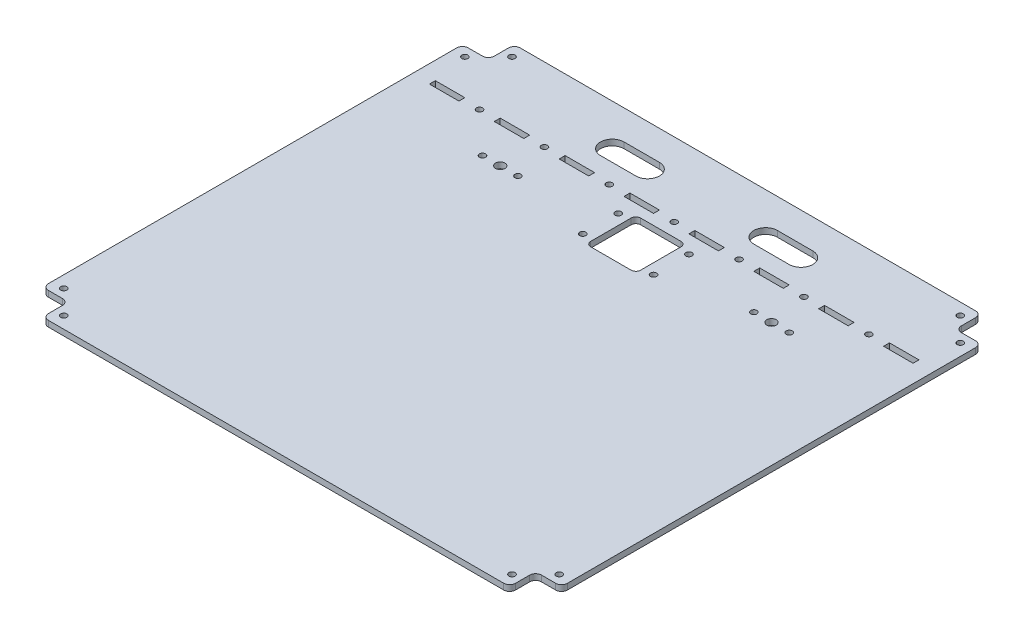
from build123d import *

# Parameters (mm, degrees)
SKETCH1_W               = 440
SKETCH1_H               = 400
BOSS_EXTRUDE1_DEPTH     = 2.5
SKETCH2_W               = 22
SKETCH2_H               = 22
CUT_EXTRUDE1_DEPTH      = 5
SKETCH3_R               = 2.6
CUT_EXTRUDE2_DEPTH      = 5
MIRROR2_COPY_1_SKETCH_W = 22
MIRROR2_COPY_1_SKETCH_H = 22
MIRROR2_COPY_1_DEPTH    = 5
MIRROR2_COPY_2_SKETCH_R = 2.6
MIRROR2_COPY_2_DEPTH    = 5
FILLET1_R               = 5
SKETCH4_W               = 25
SKETCH4_H               = 5
CUT_EXTRUDE3_DEPTH      = 5
LPATTERN1_COUNT         = 8
LPATTERN1_PITCH         = 55
SKETCH5_R               = 2.6
CUT_EXTRUDE4_DEPTH      = 5
LPATTERN2_COUNT         = 7
LPATTERN2_PITCH         = 55
SKETCH6_W               = 42.3
SKETCH6_H               = 42.3
CUT_EXTRUDE5_DEPTH      = 5
FILLET2_R               = 4
SKETCH7_R               = 2.6
CUT_EXTRUDE7_DEPTH      = 5
LPATTERN3_COUNT         = 2
LPATTERN3_PITCH         = 60
LPATTERN3_COUNT_DIR2    = 2
LPATTERN3_PITCH_DIR2    = 30
SKETCH8_R               = 4
SKETCH8_R_2             = 2.6
CUT_EXTRUDE8_DEPTH      = 5
CUT_EXTRUDE9_DEPTH      = 5


with BuildPart() as part:
    # Sketch1 → Boss-Extrude1 (new, symmetric)
    with BuildSketch(Plane(origin=(0, 0, 0), x_dir=(1, 0, 0), z_dir=(0, 1, 0))):
        Rectangle(SKETCH1_W, SKETCH1_H)
    extrude(amount=BOSS_EXTRUDE1_DEPTH, both=True)

    # Sketch2 → Cut-Extrude1 (cut)
    with BuildSketch(Plane(origin=(0, 2.5, 0), x_dir=(1, 0, 0), z_dir=(0, 1, 0))):
        with Locations((209, 189)):
            Rectangle(SKETCH2_W, SKETCH2_H)
    cut_extrude1 = extrude(amount=-CUT_EXTRUDE1_DEPTH, mode=Mode.SUBTRACT)

    # Sketch3 → Cut-Extrude2 (cut)
    with BuildSketch(Plane(origin=(0, 2.5, 0), x_dir=(1, 0, 0), z_dir=(0, 1, 0))):
        with Locations(Location((190, 190, 0), (0, 0, 270))):
            Circle(SKETCH3_R)
        with Locations(Location((210, 170, 0), (0, 0, 270))):
            Circle(SKETCH3_R)
    cut_extrude2 = extrude(amount=-CUT_EXTRUDE2_DEPTH, mode=Mode.SUBTRACT)

    # Mirror1: Cut-Extrude1, Cut-Extrude2 across plane
    add(cut_extrude1.mirror(Plane(origin=(0, 0, 0), x_dir=(0, 0, 1), z_dir=(1, 0, 0))), mode=Mode.SUBTRACT)
    add(cut_extrude2.mirror(Plane(origin=(0, 0, 0), x_dir=(0, 0, 1), z_dir=(1, 0, 0))), mode=Mode.SUBTRACT)

    # Mirror2: Cut-Extrude1, Cut-Extrude2 across plane
    add(cut_extrude1.mirror(Plane.XY), mode=Mode.SUBTRACT)
    add(cut_extrude2.mirror(Plane.XY), mode=Mode.SUBTRACT)

    # Mirror2 copy 1 sketch → Mirror2 copy 1 (cut)
    with BuildSketch(Plane(origin=(0, 2.5, 0), x_dir=(-1, 0, 0), z_dir=(0, 1, 0))):
        with Locations((209, 189)):
            Rectangle(MIRROR2_COPY_1_SKETCH_W, MIRROR2_COPY_1_SKETCH_H)
    extrude(amount=-MIRROR2_COPY_1_DEPTH, mode=Mode.SUBTRACT)

    # Mirror2 copy 2 sketch → Mirror2 copy 2 (cut)
    with BuildSketch(Plane(origin=(0, 2.5, 0), x_dir=(-1, 0, 0), z_dir=(0, 1, 0))):
        with Locations(Location((190, 190, 0), (0, 0, 270))):
            Circle(MIRROR2_COPY_2_SKETCH_R)
        with Locations(Location((210, 170, 0), (0, 0, 270))):
            Circle(MIRROR2_COPY_2_SKETCH_R)
    extrude(amount=-MIRROR2_COPY_2_DEPTH, mode=Mode.SUBTRACT)

    # Fillet1
    fillet1_edges = [part.edges().sort_by_distance(p)[0] for p in [
        (220, 0, -178),
        (198, 0, -178),
        (198, 0, -200),
        (-198, 0, -178),
        (-198, 0, -200),
        (-220, 0, -178),
        (-220, 0, 178),
        (-198, 0, 178),
        (-198, 0, 200),
        (198, 0, 178),
        (198, 0, 200),
        (220, 0, 178),
    ]]
    fillet(fillet1_edges, radius=FILLET1_R)

    # Sketch4 → Cut-Extrude3 (cut)
    with BuildSketch(Plane(origin=(0, 2.5, 0), x_dir=(1, 0, 0), z_dir=(0, 1, 0))):
        with Locations((-192.5, 137.5)):
            Rectangle(SKETCH4_W, SKETCH4_H)
    cut_extrude3 = extrude(amount=-CUT_EXTRUDE3_DEPTH, mode=Mode.SUBTRACT)

    # LPattern1: Cut-Extrude3 ×8
    with Locations(*[(i * LPATTERN1_PITCH, 0, 0) for i in range(1, LPATTERN1_COUNT)]):
        add(cut_extrude3, mode=Mode.SUBTRACT)

    # Sketch5 → Cut-Extrude4 (cut)
    with BuildSketch(Plane(origin=(0, 2.5, 0), x_dir=(1, 0, 0), z_dir=(0, 1, 0))):
        with Locations(Location((-165, 137.5, 0), (0, 0, 270))):
            Circle(SKETCH5_R)
    cut_extrude4 = extrude(amount=-CUT_EXTRUDE4_DEPTH, mode=Mode.SUBTRACT)

    # LPattern2: Cut-Extrude4 ×7
    with Locations(*[(i * LPATTERN2_PITCH, 0, 0) for i in range(1, LPATTERN2_COUNT)]):
        add(cut_extrude4, mode=Mode.SUBTRACT)

    # Sketch6 → Cut-Extrude5 (cut)
    with BuildSketch(Plane(origin=(0, 2.5, 0), x_dir=(1, 0, 0), z_dir=(0, 1, 0))):
        with Locations((0, 105)):
            Rectangle(SKETCH6_W, SKETCH6_H)
    extrude(amount=-CUT_EXTRUDE5_DEPTH, mode=Mode.SUBTRACT)

    # Fillet2
    fillet2_edges = [part.edges().sort_by_distance(p)[0] for p in [
        (21.15, 0, -126.15),
        (21.15, 0, -83.85),
        (-21.15, 0, -83.85),
        (-21.15, 0, -126.15),
    ]]
    fillet(fillet2_edges, radius=FILLET2_R)

    # Sketch7 → Cut-Extrude7 (cut)
    with BuildSketch(Plane(origin=(0, 2.5, 0), x_dir=(1, 0, 0), z_dir=(0, 1, 0))):
        with Locations(Location((30, 120, 0), (0, 0, 270))):
            Circle(SKETCH7_R)
    cut_extrude7 = extrude(amount=-CUT_EXTRUDE7_DEPTH, mode=Mode.SUBTRACT)

    # LPattern3: Cut-Extrude7 2 × 2
    with Locations(*[(-i * LPATTERN3_PITCH, 0, j * LPATTERN3_PITCH_DIR2) for i in range(LPATTERN3_COUNT) for j in range(LPATTERN3_COUNT_DIR2) if (i, j) != (0, 0)]):
        add(cut_extrude7, mode=Mode.SUBTRACT)

    # Sketch8 → Cut-Extrude8 (cut)
    with BuildSketch(Plane(origin=(0, 2.5, 0), x_dir=(1, 0, 0), z_dir=(0, 1, 0))):
        with Locations(Location((-115, 105, 0), (0, 0, 270))):
            Circle(SKETCH8_R)
        with Locations(Location((-100, 105, 0), (0, 0, 270))):
            Circle(SKETCH8_R_2)
        with Locations(Location((-130, 105, 0), (0, 0, 270))):
            Circle(SKETCH8_R_2)
    cut_extrude8 = extrude(amount=-CUT_EXTRUDE8_DEPTH, mode=Mode.SUBTRACT)

    # Mirror3: Cut-Extrude8 across plane
    add(cut_extrude8.mirror(Plane(origin=(0, 0, 0), x_dir=(0, 0, 1), z_dir=(1, 0, 0))), mode=Mode.SUBTRACT)

    # Sketch9 → Cut-Extrude9 (cut)
    with BuildSketch(Plane(origin=(0, 2.5, 0), x_dir=(1, 0, 0), z_dir=(0, 1, 0))):
        with BuildLine():
            Line((50, 175), (80, 175))
            ThreePointArc((80, 175), (90, 165), (80, 155))
            Line((80, 155), (50, 155))
            ThreePointArc((50, 155), (40, 165), (50, 175))
        make_face()
    cut_extrude9 = extrude(amount=-CUT_EXTRUDE9_DEPTH, mode=Mode.SUBTRACT)

    # Mirror4: Cut-Extrude9 across plane
    add(cut_extrude9.mirror(Plane(origin=(0, 0, 0), x_dir=(0, 0, 1), z_dir=(1, 0, 0))), mode=Mode.SUBTRACT)


solid = part.part
